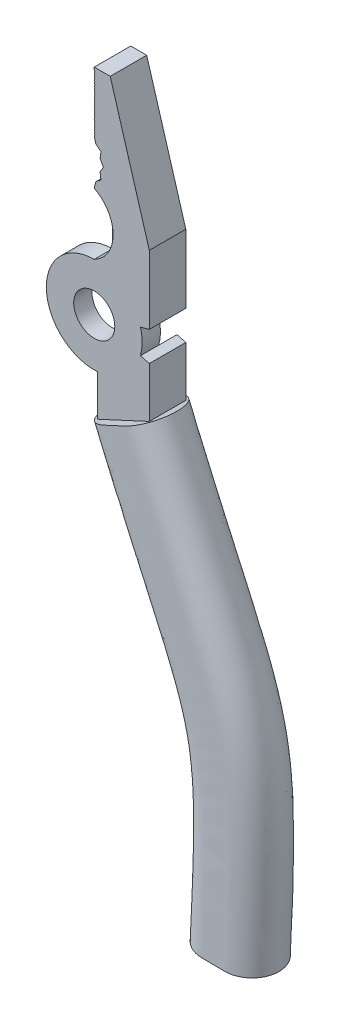
from build123d import *

# Parameters (mm, degrees)
BOSS_EXTRUDE1_DEPTH                 = 8
SKETCH1_3_R                         = 4.5
BOSS_EXTRUDE2_DEPTH                 = 4
BOSS_EXTRUDE3_DEPTH                 = 8
CUT_EXTRUDE1_DEPTH                  = 4
DRAFT1_ANGLE                        = 1
DRAFT2_ANGLE                        = 30
CUT_EXTRUDE2_REACH                  = 100.996
CUT_EXTRUDE2_END_RADIUS             = 7.571153535
CUT_EXTRUDE2_START                  = -30
CUT_EXTRUDE2_DIRECTION_2_REACH      = 100.996
CUT_EXTRUDE2_DIRECTION_2_END_RADIUS = 7.571153535


with BuildPart() as part:
    # Sketch1 → Boss-Extrude1 (new body)
    with BuildSketch(Plane.XY):
        with BuildLine():
            Line((-2.665163662, 3.723158213), (-6.165163662, 3.723158213))
            Line((-6.165163662, 3.723158213), (-6.165163662, 3.223158213))
            Line((-6.165163662, 3.223158213), (-6.020826094, 2.973158213))
            Line((-6.020826094, 2.973158213), (-6.165163662, 2.723158213))
            Line((-6.165163662, 2.723158213), (-6.020826094, 2.473158213))
            Line((-6.020826094, 2.473158213), (-6.165163662, 2.223158213))
            Line((-6.165163662, 2.223158213), (-6.020826094, 1.973158213))
            Line((-6.020826094, 1.973158213), (-6.165163662, 1.723158213))
            Line((-6.165163662, 1.723158213), (-6.020826094, 1.473158213))
            Line((-6.020826094, 1.473158213), (-6.165163662, 1.223158213))
            Line((-6.165163662, 1.223158213), (-6.020826094, 0.973158213))
            Line((-6.020826094, 0.973158213), (-6.165163662, 0.723158213))
            Line((-6.165163662, 0.723158213), (-6.020826094, 0.473158213))
            Line((-6.020826094, 0.473158213), (-6.165163662, 0.223158213))
            Line((-6.165163662, 0.223158213), (-6.020826094, -0.026841787))
            Line((-6.020826094, -0.026841787), (-6.165163662, -0.276841787))
            Line((-6.165163662, -0.276841787), (-6.020826094, -0.526841787))
            Line((-6.020826094, -0.526841787), (-6.165163662, -0.776841787))
            Line((-6.165163662, -0.776841787), (-6.020826094, -1.026841787))
            Line((-6.020826094, -1.026841787), (-6.165163662, -1.276841787))
            Line((-6.165163662, -1.276841787), (-6.020826094, -1.526841787))
            Line((-6.020826094, -1.526841787), (-6.165163662, -1.776841787))
            Line((-6.165163662, -1.776841787), (-6.020826094, -2.026841787))
            Line((-6.020826094, -2.026841787), (-6.165163662, -2.276841787))
            Line((-6.165163662, -2.276841787), (-6.020826094, -2.526841787))
            Line((-6.020826094, -2.526841787), (-6.165163662, -2.776841787))
            Line((-6.165163662, -2.776841787), (-6.020826094, -3.026841787))
            Line((-6.020826094, -3.026841787), (-6.165163662, -3.276841787))
            Line((-6.165163662, -3.276841787), (-6.020826094, -3.526841787))
            Line((-6.020826094, -3.526841787), (-6.165163662, -3.776841787))
            Line((-6.165163662, -3.776841787), (-6.020826094, -4.026841787))
            Line((-6.020826094, -4.026841787), (-6.165163662, -4.276841787))
            Line((-6.165163662, -4.276841787), (-6.020826094, -4.526841787))
            Line((-6.020826094, -4.526841787), (-6.165163662, -4.776841787))
            Line((-6.165163662, -4.776841787), (-6.020826094, -5.026841787))
            Line((-6.020826094, -5.026841787), (-6.165163662, -5.276841787))
            Line((-6.165163662, -5.276841787), (-6.020826094, -5.526841787))
            Line((-6.020826094, -5.526841787), (-6.165163662, -5.776841787))
            Line((-6.165163662, -5.776841787), (-6.020826094, -6.026841787))
            Line((-6.020826094, -6.026841787), (-6.165163662, -6.276841787))
            Line((-6.165163662, -6.276841787), (-6.020826094, -6.526841787))
            Line((-6.020826094, -6.526841787), (-6.165163662, -6.776841787))
            Line((-6.165163662, -6.776841787), (-6.020826094, -7.026841787))
            Line((-6.020826094, -7.026841787), (-6.165163662, -7.276841787))
            Line((-6.165163662, -7.276841787), (-6.020826094, -7.526841787))
            Line((-6.020826094, -7.526841787), (-6.165163662, -7.776841787))
            Line((-6.165163662, -7.776841787), (-6.020826094, -8.026841787))
            Line((-6.020826094, -8.026841787), (-6.165163662, -8.276841787))
            Line((-6.165163662, -8.276841787), (-6.020826094, -8.526841787))
            Line((-6.020826094, -8.526841787), (-6.165163662, -8.776841787))
            Line((-6.165163662, -8.776841787), (-6.020826094, -9.026841787))
            Line((-6.020826094, -9.026841787), (-6.165163662, -9.276841787))
            Line((-6.165163662, -9.276841787), (-5.819249533, -10.684037163))
            Line((-5.819249533, -10.684037163), (-4.683707653, -11.584259383))
            Line((-4.683707653, -11.584259383), (-4.88515369, -13.019276771))
            Line((-4.88515369, -13.019276771), (-4.165163662, -14.276841787))
            Line((-4.165163662, -14.276841787), (-4.88515369, -15.534406803))
            Line((-4.88515369, -15.534406803), (-4.683707653, -16.969424191))
            Line((-4.683707653, -16.969424191), (-5.819249533, -17.869646411))
            Line((-5.819249533, -17.869646411), (-6.165163662, -19.276841787))
            Line((-6.165163662, -19.276841787), (-6.165163662, -32.776841787))
            ThreePointArc((-6.165163662, -32.776841787), (0.226831343, -34.946631714), (3.977057514, -40.559241813))
            Line((3.977057514, -40.559241813), (5.908909167, -40.041603723))
            Line((5.908909167, -40.041603723), (5.908909167, -25.025498714))
            Line((5.908909167, -25.025498714), (-2.665163662, 3.723158213))
        make_face()
    extrude(amount=-BOSS_EXTRUDE1_DEPTH)

    # Sketch1<3> → Boss-Extrude2 (add)
    with BuildSketch(Plane.XY):
        with BuildLine():
            ThreePointArc((4.334836338, -43.276841787), (4.245007383, -41.906316769), (3.977057514, -40.559241813))
            ThreePointArc((3.977057514, -40.559241813), (0.226831343, -34.946631714), (-6.165163662, -32.776841787))
            ThreePointArc((-6.165163662, -32.776841787), (-16.658456528, -43.652081481), (-5.415163662, -53.75002182))
            ThreePointArc((-5.415163662, -53.75002182), (0.520445963, -51.373299281), (3.977057514, -45.994441761))
            ThreePointArc((3.977057514, -45.994441761), (4.245007383, -44.647366805), (4.334836338, -43.276841787))
        make_face()
        with Locations((-6.165163662, -43.276841787)):
            Circle(SKETCH1_3_R, mode=Mode.SUBTRACT)
    extrude(amount=-BOSS_EXTRUDE2_DEPTH)

    # Sketch1<4> → Boss-Extrude3 (add)
    with BuildSketch(Plane.XY):
        with BuildLine():
            Line((5.908909167, -46.512079851), (3.977057514, -45.994441761))
            ThreePointArc((3.977057514, -45.994441761), (0.520445963, -51.373299281), (-5.415163662, -53.75002182))
            Line((-5.415163662, -53.75002182), (-5.415163662, -62.75002182))
            Line((-5.415163662, -62.75002182), (5.908909167, -57.512079851))
            Line((5.908909167, -57.512079851), (5.908909167, -46.512079851))
        make_face()
    extrude(amount=-BOSS_EXTRUDE3_DEPTH)

    # Sketch2 → Cut-Extrude1 (cut)
    with BuildSketch(Plane.XY):
        with BuildLine():
            Line((-6.165163662, -19.276841787), (-6.165163662, -32.776841787))
            ThreePointArc((-6.165163662, -32.776841787), (-2.023276207, -26.026841787), (-6.165163662, -19.276841787))
        make_face()
    extrude(amount=-CUT_EXTRUDE1_DEPTH, mode=Mode.SUBTRACT)

    # Draft1
    draft1_faces = [part.faces().sort_by_distance(p)[0] for p in [
        (-4.462150227, -26.026841787, -4),
    ]]
    draft(draft1_faces, Plane(origin=(-6.165163662, 0, -8), x_dir=(0, -1, 0), z_dir=(-1, 0, 0)), DRAFT1_ANGLE)

    # Draft2
    draft2_faces = [part.faces().sort_by_distance(p)[0] for p in [
        (-4.462150227, -26.026841787, -3.97027379),
    ]]
    draft(draft2_faces, Plane(origin=(-6.165163662, 0, -8), x_dir=(0, -1, 0), z_dir=(-1, 0, 0)), DRAFT2_ANGLE)

    # Cut-Extrude2: up to this cylinder (the profile starts inside it)
    cut_extrude2_end = Plane(origin=(-9.594429741, -26.026841787, -6.821489), z_dir=(0, 0, 1)) * Cylinder(CUT_EXTRUDE2_END_RADIUS, 218.134307069, mode=Mode.PRIVATE)
    # Sketch3 → Cut-Extrude2 (cut, up to the surface)
    with BuildSketch(Plane(origin=(0, 3.723158213, 0), x_dir=(1, 0, 0), z_dir=(0, 1, 0)).offset(CUT_EXTRUDE2_START), mode=Mode.PRIVATE) as cut_extrude2_sk1:
        Polygon((-6.165163662, 4.464466094), (-2.629629756, 8), (-6.165163662, 8), align=None)
    cut_extrude2_tool1 = extrude(cut_extrude2_sk1.sketch, amount=CUT_EXTRUDE2_REACH, mode=Mode.PRIVATE) & cut_extrude2_end
    add(cut_extrude2_tool1.solids().sort_by_distance((-4.986652, -26.276842, -6.821489))[0], mode=Mode.SUBTRACT)

    # Cut-Extrude2 direction 2: up to this cylinder (the profile starts inside it)
    cut_extrude2_direction_2_end = Plane(origin=(-9.594429741, -26.026841787, -6.821489), z_dir=(0, 0, 1)) * Cylinder(CUT_EXTRUDE2_DIRECTION_2_END_RADIUS, 218.134307069, mode=Mode.PRIVATE)
    # Sketch3 → Cut-Extrude2 direction 2 (cut, up to the surface)
    with BuildSketch(Plane(origin=(0, 3.723158213, 0), x_dir=(1, 0, 0), z_dir=(0, 1, 0)).offset(CUT_EXTRUDE2_START), mode=Mode.PRIVATE) as cut_extrude2_direction_2_sk1:
        Polygon((-6.165163662, 4.464466094), (-2.629629756, 8), (-6.165163662, 8), align=None)
    cut_extrude2_direction_2_tool1 = extrude(cut_extrude2_direction_2_sk1.sketch, amount=-CUT_EXTRUDE2_DIRECTION_2_REACH, mode=Mode.PRIVATE) & cut_extrude2_direction_2_end
    add(cut_extrude2_direction_2_tool1.solids().sort_by_distance((-4.986652, -26.276842, -6.821489))[0], mode=Mode.SUBTRACT)

    # Sweep1: sweep along a path in Sketch5
    with BuildLine() as sweep1_path:  # in the path sketch's own coordinates; laid on its plane below (add() does not lay a ready-made edge on the line's plane)
        add(Edge.make_bspline(
            [(0.223551669, -60.141837986), (21.749513364, -111.274227055), (24.236934906, -103.098193166), (21.841154622, -151.61274391)],
            knots=[0, 0, 0, 0, 1, 1, 1, 1], degree=3))
    # Sketch4 → Sweep1 (sweep)
    with BuildSketch(Plane(origin=(22.955106723, -49.62737309, 0), x_dir=(0.9076099917812164, 0.419814367094434, 0), z_dir=(0.41981436709443404, -0.9076099917812165, 0))):
        with BuildLine():
            Line((-27.545509922, -1), (-22.545509922, -1))
            ThreePointArc((-22.545509922, -1), (-19.545509922, -4), (-22.545509922, -7))
            Line((-22.545509922, -7), (-27.545509922, -7))
            ThreePointArc((-27.545509922, -7), (-30.545509922, -4), (-27.545509922, -1))
        make_face()
    sweep(path=Plane.XY.offset(-4) * sweep1_path.line)

    # Sweep3: sweep along a path in Sketch5<3>
    with BuildLine() as sweep3_path:  # in the path sketch's own coordinates; laid on its plane below (add() does not lay a ready-made edge on the line's plane)
        add(Edge.make_bspline(
            [(0.223551669, -60.141837986), (21.749513364, -111.274227055), (24.236934906, -103.098193166), (21.841154622, -151.61274391)],
            knots=[0, 0, 0, 0, 1, 1, 1, 1], degree=3))
    # Sketch13 → Sweep3 (sweep)
    with BuildSketch(Plane(origin=(-2.2035554, -151.26246633, 0), x_dir=(0.9998939070612703, -0.014566215079688138, 0), z_dir=(-0.014566215079688138, -0.9998939070612703, 0))):
        with BuildLine():
            Line((21.547261266, -10), (26.547261266, -10))
            ThreePointArc((26.547261266, -10), (32.547261266, -4), (26.547261266, 2))
            Line((26.547261266, 2), (21.547261266, 2))
            ThreePointArc((21.547261266, 2), (15.547261266, -4), (21.547261266, -10))
        make_face()
    sweep(path=Plane.XY.offset(-4) * sweep3_path.line)


solid = part.part
